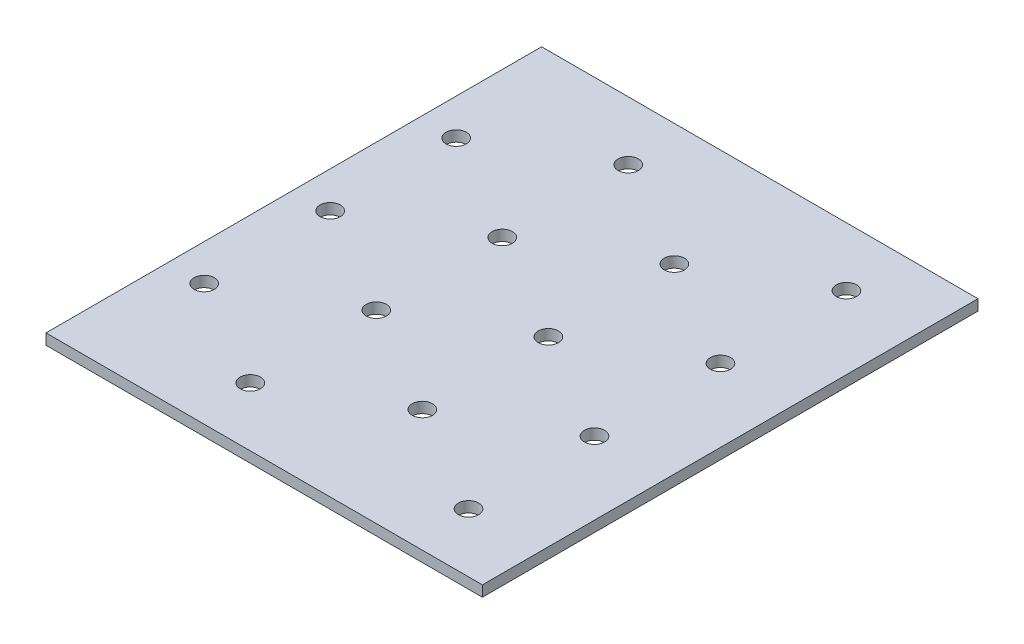
from build123d import *

# Parameters (mm, degrees)
SKETCH1_W         = 258
SKETCH1_H         = 293
MAIN_BASE_DEPTH   = 3.175
ALIGNMENT_HOLES_D = 12


with BuildPart() as part:
    # Sketch1 → Main Base (new, symmetric)
    with BuildSketch(Plane(origin=(0, 0, 0), x_dir=(1, 0, 0), z_dir=(0, 1, 0))):
        Rectangle(SKETCH1_W, SKETCH1_H)
    extrude(amount=MAIN_BASE_DEPTH, both=True)

    # Alignment Holes (through all)
    with Locations(Plane(origin=(0, 3.175, 0), x_dir=(1, 0, 0), z_dir=(0, 1, 0))):
        with Locations((-107.5, 0), (-43, -37.239092363), (-43, 37.239092363), (86, 37.239092363), (21.5, 0), (86, -37.239092363), (-107.5, 74.478184725), (-43, 111.717277088), (21.5, 74.478184725), (86, 111.717277088), (-107.5, -74.478184725), (-43, -111.717277088), (21.5, -74.478184725), (86, -111.717277088)):
            Hole(ALIGNMENT_HOLES_D / 2)


solid = part.part
